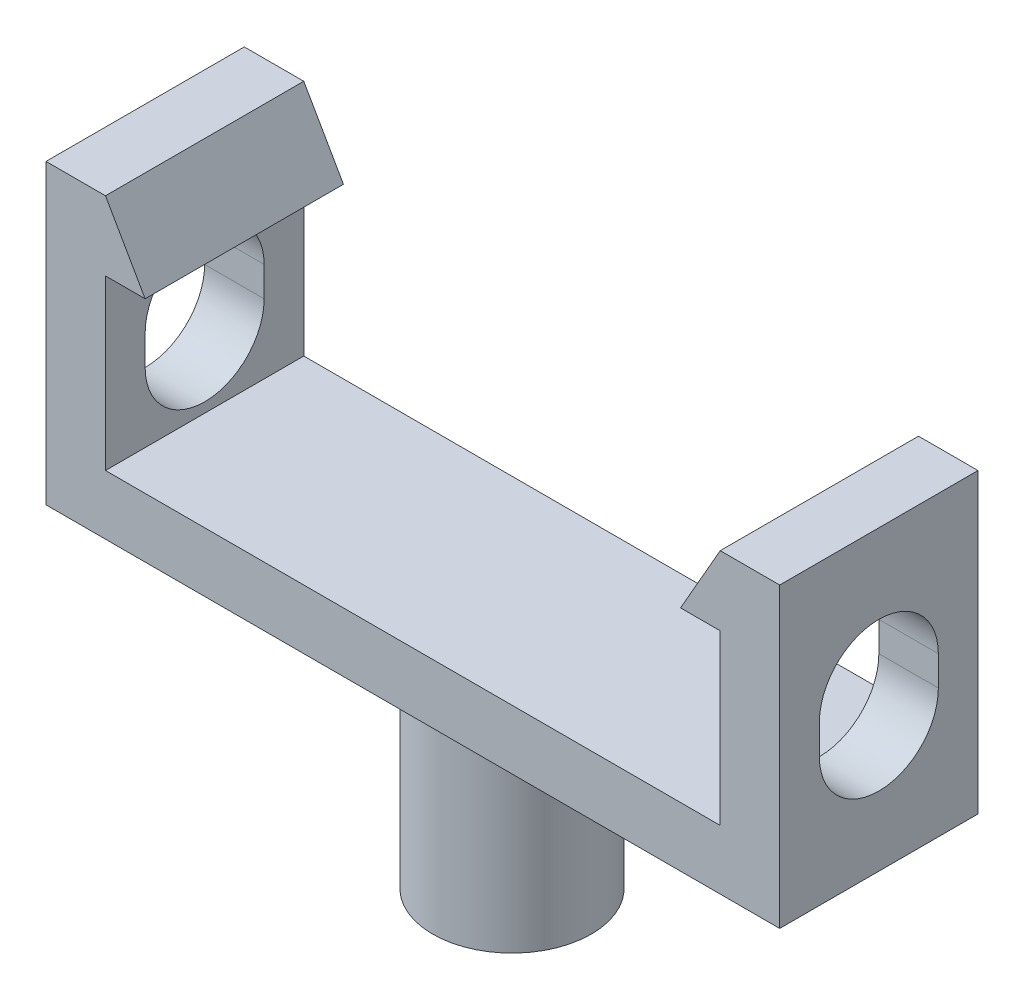
from build123d import *

# Parameters (mm, degrees)
BOSS_EXTRUDE1_DEPTH = 10
CUT_EXTRUDE1_DEPTH  = 41.162171256
SKETCH3_R           = 4
BOSS_EXTRUDE2_DEPTH = 10


with BuildPart() as part:
    # Sketch1 → Boss-Extrude1 (new body)
    with BuildSketch(Plane.XY):
        Polygon((0, 0), (0, 8.5), (2, 8.5), (0, 12), (-3, 12), (-3, -3), (34, -3), (34, 12), (31, 12), (29, 8.5), (31, 8.5), (31, 0), align=None)
    extrude(amount=BOSS_EXTRUDE1_DEPTH)

    # Sketch2 → Cut-Extrude1 (cut, through all)
    with BuildSketch(Plane.ZY.offset(3)):
        with BuildLine():
            Line((8, 5), (8, 3.5))
            ThreePointArc((8, 3.5), (5, 0.5), (2, 3.5))
            Line((2, 3.5), (2, 5))
            ThreePointArc((2, 5), (5, 8), (8, 5))
        make_face()
    extrude(amount=-CUT_EXTRUDE1_DEPTH, mode=Mode.SUBTRACT)

    # Sketch3 → Boss-Extrude2 (add)
    with BuildSketch(Plane.XZ.offset(3)):
        with Locations((15.5, 5)):
            Circle(SKETCH3_R)
    extrude(amount=BOSS_EXTRUDE2_DEPTH)


solid = part.part
